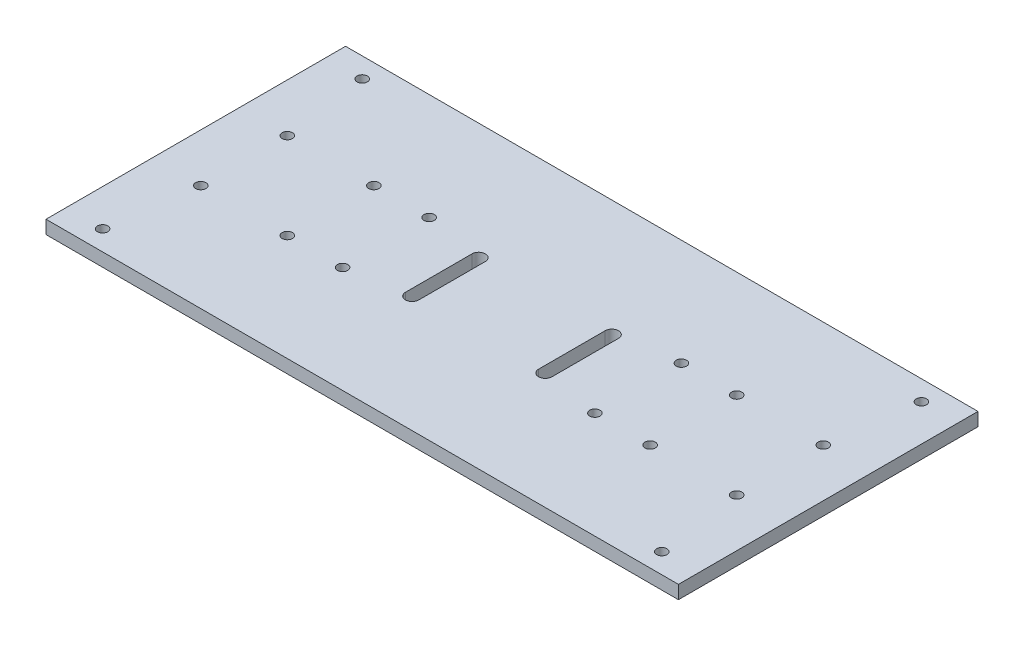
from build123d import *

# Parameters (mm, degrees)
SKETCH_1_W      = 180
SKETCH_1_H      = 90
SKETCH_1_R      = 1.55
EXTRUDE_1_DEPTH = 4
SKETCH_3_W      = 90
SKETCH_3_H      = 4
EXTRUDE_2_DEPTH = 5
SKETCH_4_W      = 90
SKETCH_4_H      = 4
EXTRUDE_3_DEPTH = 5


with BuildPart() as part:
    # 草图1 → 凸台-拉伸1 (new body)
    with BuildSketch(Plane(origin=(0, 0, 0), x_dir=(1, 0, 0), z_dir=(0, 1, 0))):
        with Locations((90, 45)):
            Rectangle(SKETCH_1_W, SKETCH_1_H)
        with Locations(Location((9.5, 58, 0), (0, 0, 270))):
            Circle(SKETCH_1_R, mode=Mode.SUBTRACT)
        with Locations(Location((35.5, 58, 0), (0, 0, 270))):
            Circle(SKETCH_1_R, mode=Mode.SUBTRACT)
        with Locations(Location((35.5, 32, 0), (0, 0, 270))):
            Circle(SKETCH_1_R, mode=Mode.SUBTRACT)
        with Locations(Location((9.5, 32, 0), (0, 0, 270))):
            Circle(SKETCH_1_R, mode=Mode.SUBTRACT)
        with Locations(Location((144.5, 58, 0), (0, 0, 90))):
            Circle(SKETCH_1_R, mode=Mode.SUBTRACT)
        with Locations(Location((170.5, 58, 0), (0, 0, 90))):
            Circle(SKETCH_1_R, mode=Mode.SUBTRACT)
        with Locations(Location((170.5, 32, 0), (0, 0, 90))):
            Circle(SKETCH_1_R, mode=Mode.SUBTRACT)
        with Locations(Location((144.5, 32, 0), (0, 0, 90))):
            Circle(SKETCH_1_R, mode=Mode.SUBTRACT)
        with Locations(Location((127.9, 58, 0), (0, 0, 270))):
            Circle(SKETCH_1_R, mode=Mode.SUBTRACT)
        with Locations(Location((174, 84, 0), (0, 0, 270))):
            Circle(SKETCH_1_R, mode=Mode.SUBTRACT)
        with Locations(Location((174, 6, 0), (0, 0, 90))):
            Circle(SKETCH_1_R, mode=Mode.SUBTRACT)
        with Locations(Location((6, 6, 0), (0, 0, 270))):
            Circle(SKETCH_1_R, mode=Mode.SUBTRACT)
        with Locations(Location((6, 84, 0), (0, 0, 90))):
            Circle(SKETCH_1_R, mode=Mode.SUBTRACT)
        with Locations(Location((52.1, 58, 0), (0, 0, 90))):
            Circle(SKETCH_1_R, mode=Mode.SUBTRACT)
        with Locations(Location((127.9, 32, 0), (0, 0, 90))):
            Circle(SKETCH_1_R, mode=Mode.SUBTRACT)
        with Locations(Location((52.1, 32, 0), (0, 0, 270))):
            Circle(SKETCH_1_R, mode=Mode.SUBTRACT)
        with BuildLine():
            Line((68, 35), (68, 55))
            ThreePointArc((68, 55), (70, 57), (72, 55))
            Line((72, 55), (72, 35))
            ThreePointArc((72, 35), (70, 33), (68, 35))
        make_face(mode=Mode.SUBTRACT)
        with BuildLine():
            Line((112, 35), (112, 55))
            ThreePointArc((112, 55), (110, 57), (108, 55))
            Line((108, 55), (108, 35))
            ThreePointArc((108, 35), (110, 33), (112, 35))
        make_face(mode=Mode.SUBTRACT)
    extrude(amount=EXTRUDE_1_DEPTH)

    # 草图3 → 凸台-拉伸2 (add)
    with BuildSketch(Plane.ZY):
        with Locations((-45, 2)):
            Rectangle(SKETCH_3_W, SKETCH_3_H)
    extrude(amount=EXTRUDE_2_DEPTH)

    # 草图4 → 凸台-拉伸3 (add)
    with BuildSketch(Plane(origin=(180, 0, 0), x_dir=(0, 0, -1), z_dir=(1, 0, 0))):
        with Locations((45, 2)):
            Rectangle(SKETCH_4_W, SKETCH_4_H)
    extrude(amount=EXTRUDE_3_DEPTH)


solid = part.part
